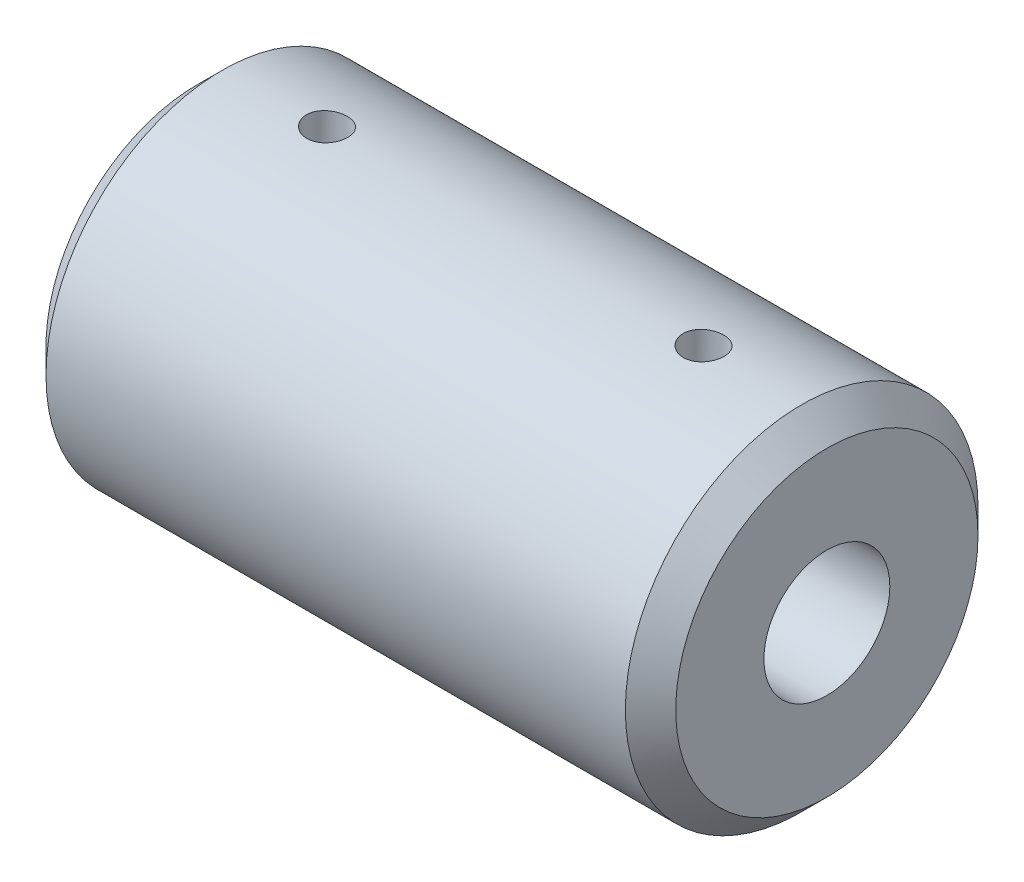
from build123d import *

# Parameters (mm, degrees)
CROQUIS1_R                          = 7
SALIENTE_EXTRUIR1_DEPTH             = 25
CROQUIS2_R                          = 2.5
CORTAR_EXTRUIR1_DEPTH               = 12.5
CROQUIS3_R                          = 4
CORTAR_EXTRUIR2_DEPTH               = 12.5
CHAFL_N1_SIZE                       = 1
CHAFL_N2_SIZE                       = 1
TALADRO_DE_MARGEN_PARA_M1_41_REACH  = 27.44
TALADRO_DE_MARGEN_PARA_M1_41_BORE_R = 0.8
TALADRO_DE_MARGEN_PARA_M1_42_REACH  = 27.426
TALADRO_DE_MARGEN_PARA_M1_42_BORE_R = 0.8


with BuildPart() as part:
    # Croquis1 → Saliente-Extruir1 (new body)
    with BuildSketch(Plane(origin=(0, 0, 0), x_dir=(0, 0, -1), z_dir=(1, 0, 0))):
        Circle(CROQUIS1_R)
    extrude(amount=SALIENTE_EXTRUIR1_DEPTH)

    # Croquis2 → Cortar-Extruir1 (cut)
    with BuildSketch(Plane(origin=(25, 0, 0), x_dir=(0, 0, -1), z_dir=(1, 0, 0))):
        Circle(CROQUIS2_R)
    extrude(amount=-CORTAR_EXTRUIR1_DEPTH, mode=Mode.SUBTRACT)

    # Croquis3 → Cortar-Extruir2 (cut)
    with BuildSketch(Plane.ZY):
        Circle(CROQUIS3_R)
    extrude(amount=-CORTAR_EXTRUIR2_DEPTH, mode=Mode.SUBTRACT)

    # Chaflán1
    chafl_n1_edges = [part.edges().sort_by_distance(p)[0] for p in [
        (25, 0, 7),
    ]]
    chamfer(chafl_n1_edges, length=CHAFL_N1_SIZE)

    # Chaflán2
    chafl_n2_edges = [part.edges().sort_by_distance(p)[0] for p in [
        (0, 0, 7),
    ]]
    chamfer(chafl_n2_edges, length=CHAFL_N2_SIZE)

    # Taladro de margen para M1.41 bore (on position points) → Taladro de margen para M1.41 (cut, up to next)
    with BuildSketch(Plane(origin=(5, 6.998215778, -0.158037721), x_dir=(0, 0.022576817235, 0.999745111178), z_dir=(0, 0.999745111178, -0.022576817235)), mode=Mode.PRIVATE) as taladro_de_margen_para_m1_41_sk1:
        Circle(TALADRO_DE_MARGEN_PARA_M1_41_BORE_R)
    taladro_de_margen_para_m1_41_tool1 = extrude(taladro_de_margen_para_m1_41_sk1.sketch, amount=-TALADRO_DE_MARGEN_PARA_M1_41_REACH, mode=Mode.PRIVATE) & part.part
    add(taladro_de_margen_para_m1_41_tool1.solids().sort_by_distance((5, 6.998216, -0.158038))[0], mode=Mode.SUBTRACT)

    # Taladro de margen para M1.42 bore (on position points) → Taladro de margen para M1.42 (cut, up to next)
    with BuildSketch(Plane(origin=(20, 6.999207069, -0.10535848), x_dir=(0, 0.01505121149, 0.999886724101), z_dir=(0, 0.999886724101, -0.01505121149)), mode=Mode.PRIVATE) as taladro_de_margen_para_m1_42_sk1:
        Circle(TALADRO_DE_MARGEN_PARA_M1_42_BORE_R)
    taladro_de_margen_para_m1_42_tool1 = extrude(taladro_de_margen_para_m1_42_sk1.sketch, amount=-TALADRO_DE_MARGEN_PARA_M1_42_REACH, mode=Mode.PRIVATE) & part.part
    add(taladro_de_margen_para_m1_42_tool1.solids().sort_by_distance((20, 6.999207, -0.105358))[0], mode=Mode.SUBTRACT)


solid = part.part
